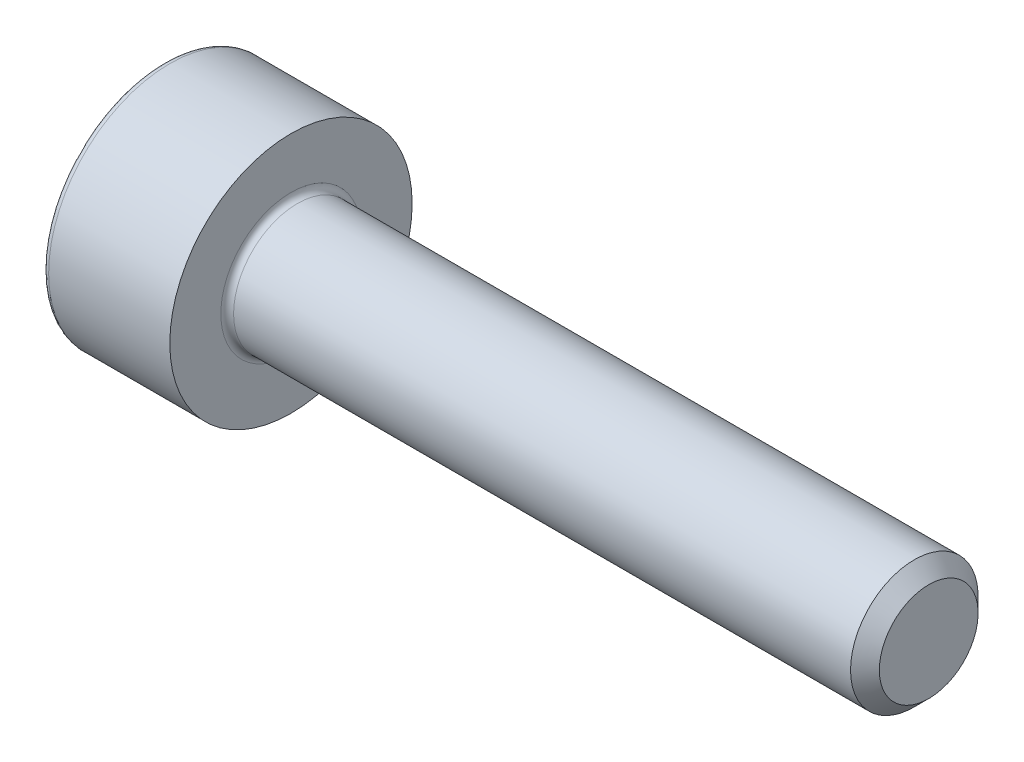
from build123d import *

# Parameters (mm, degrees)
FILLET1_R   = 0.1
FILLET2_R   = 0.1
HEX_2_DEPTH = 1


with BuildPart() as part:
    # BodySke → Base-Revolve (revolve)
    with BuildSketch(Plane.XY, mode=Mode.PRIVATE) as base_revolve_sk:
        Polygon((0, 0), (0, 1.9), (2, 1.9), (2, 1), (11.774, 1), (12, 0.774), (12, 0), align=None)
    revolve(base_revolve_sk.sketch.rotate(Axis((-31.75, 0, 0), (1, 0, 0)), 90), axis=Axis((-31.75, 0, 0), (1, 0, 0)))

    # Fillet1
    fillet1_edges = [part.edges().sort_by_distance(p)[0] for p in [
        (2, 0, -1),
    ]]
    fillet(fillet1_edges, radius=FILLET1_R)

    # Fillet2
    fillet2_edges = [part.edges().sort_by_distance(p)[0] for p in [
        (0, 0, -1.9),
    ]]
    fillet(fillet2_edges, radius=FILLET2_R)

    # Sketch2 → Hex-PreBroach (revolve, cut)
    with BuildSketch(Plane.XY, mode=Mode.PRIVATE) as hex_prebroach_sk:
        Polygon((0, 0.7725), (1, 0.7725), (1.446003083, 0), (0, 0), align=None)
    revolve(hex_prebroach_sk.sketch.rotate(Axis((0, 0, 0), (1, 0, 0)), 90), axis=Axis((0, 0, 0), (1, 0, 0)), mode=Mode.SUBTRACT)

    # Sketch3 → Hex 2 (cut)
    with BuildSketch(Plane(origin=(0, 0, 0), x_dir=(0, 0.500000000000001, 0.866025403784438), z_dir=(-1, 0, 0))):
        Polygon((0.446003083, 0.7725), (-0.446003083, 0.7725), (-0.892006166, 0), (-0.446003083, -0.7725), (0.446003083, -0.7725), (0.892006166, 0), align=None)
    extrude(amount=-HEX_2_DEPTH, mode=Mode.SUBTRACT)


solid = part.part
